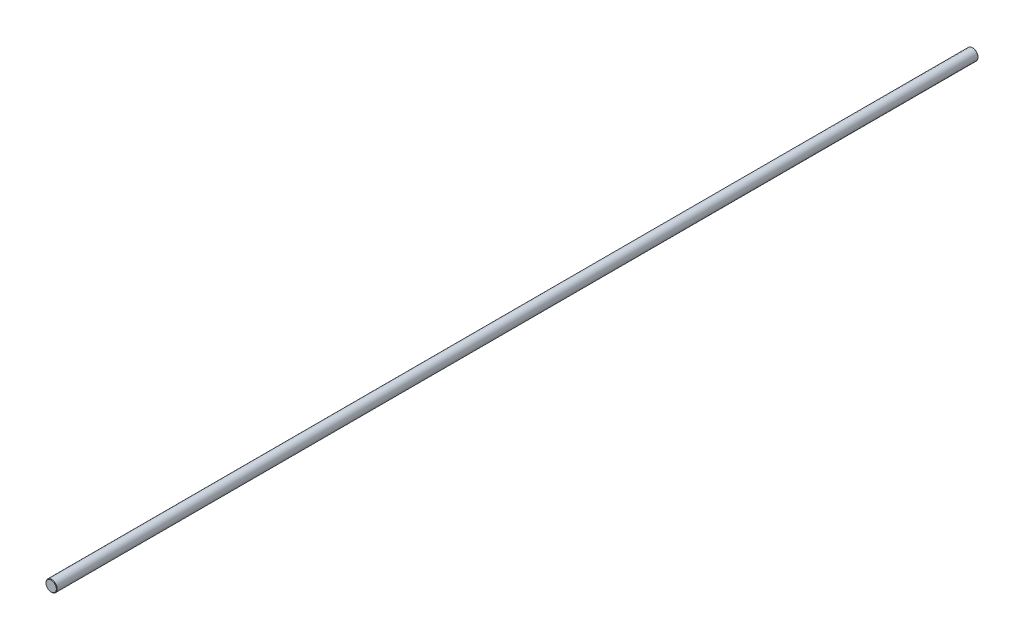
from build123d import *

# Parameters (mm, degrees)
SKETCH_1_R      = 12.5
EXTRUDE_1_DEPTH = 1027
CHAMFER_1_SIZE  = 1


with BuildPart() as part:
    # Эскиз1 → Бобышка-Вытянуть1 (new, symmetric)
    with BuildSketch(Plane.XY):
        Circle(SKETCH_1_R)
    extrude(amount=EXTRUDE_1_DEPTH, both=True)

    # Фаска1
    chamfer_1_edges = [part.edges().sort_by_distance(p)[0] for p in [
        (-12.5, 0, -1027),
        (-12.5, 0, 1027),
    ]]
    chamfer(chamfer_1_edges, length=CHAMFER_1_SIZE)


solid = part.part
